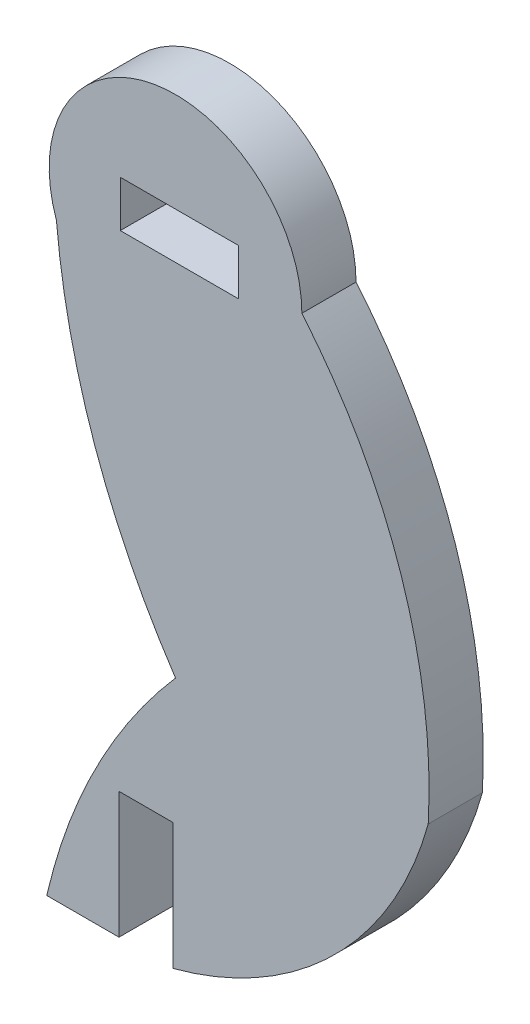
from build123d import *

# Parameters (mm, degrees)
CROQUIS1_W              = 6.56
CROQUIS1_H              = 2.56
SALIENTE_EXTRUIR1_DEPTH = 3


with BuildPart() as part:
    # Croquis1 → Saliente-Extruir1 (new body)
    # profile 1 of 4: a face of its own
    with BuildSketch(Plane.XY):
        with BuildLine():
            ThreePointArc((-6.599663594, -2.333332476), (-4.473021287, -12.08145136), (0, -21))
            ThreePointArc((0, -21), (7, -14), (14, -21))
            ThreePointArc((14, -21), (12.507710809, -9.830763064), (7, 0))
            ThreePointArc((7, 0), (-1.183713403, 6.899189994), (-6.599663594, -2.333332476))
        make_face()
        with Locations((0.22, 0.22)):
            Rectangle(CROQUIS1_W, CROQUIS1_H, mode=Mode.SUBTRACT)
    # profile 2 of 4: a face of its own
    with BuildSketch(Plane.XY):
        with BuildLine():
            ThreePointArc((14, -21), (7, -14), (0, -21))
            Line((0, -21), (14, -21))
        make_face()
    # profile 3 of 4: a face of its own
    with BuildSketch(Plane.XY):
        with BuildLine():
            Line((14, -21), (0, -21))
            ThreePointArc((0, -21), (4.213945985, -27.421674472), (11.782258008, -26.111751984))
            ThreePointArc((11.782258008, -26.111751984), (13.070021332, -23.633488722), (14, -21))
        make_face()
    # profile 4 of 4: a face of its own
    with BuildSketch(Plane.XY):
        with BuildLine():
            Line((-7.131748217, -35), (-3.131748217, -35))
            Line((-3.131748217, -35), (-3.131748217, -28))
            Line((-3.131748217, -28), (-0.131748217, -28))
            Line((-0.131748217, -28), (-0.131748217, -35))
            ThreePointArc((-0.131748217, -35), (6.681647081, -31.703803211), (11.782258008, -26.111751984))
            ThreePointArc((11.782258008, -26.111751984), (4.213945985, -27.421674472), (0, -21))
            ThreePointArc((0, -21), (-4.430558492, -27.559520621), (-7.131748217, -35))
        make_face()
    extrude(amount=SALIENTE_EXTRUIR1_DEPTH)


solid = part.part
